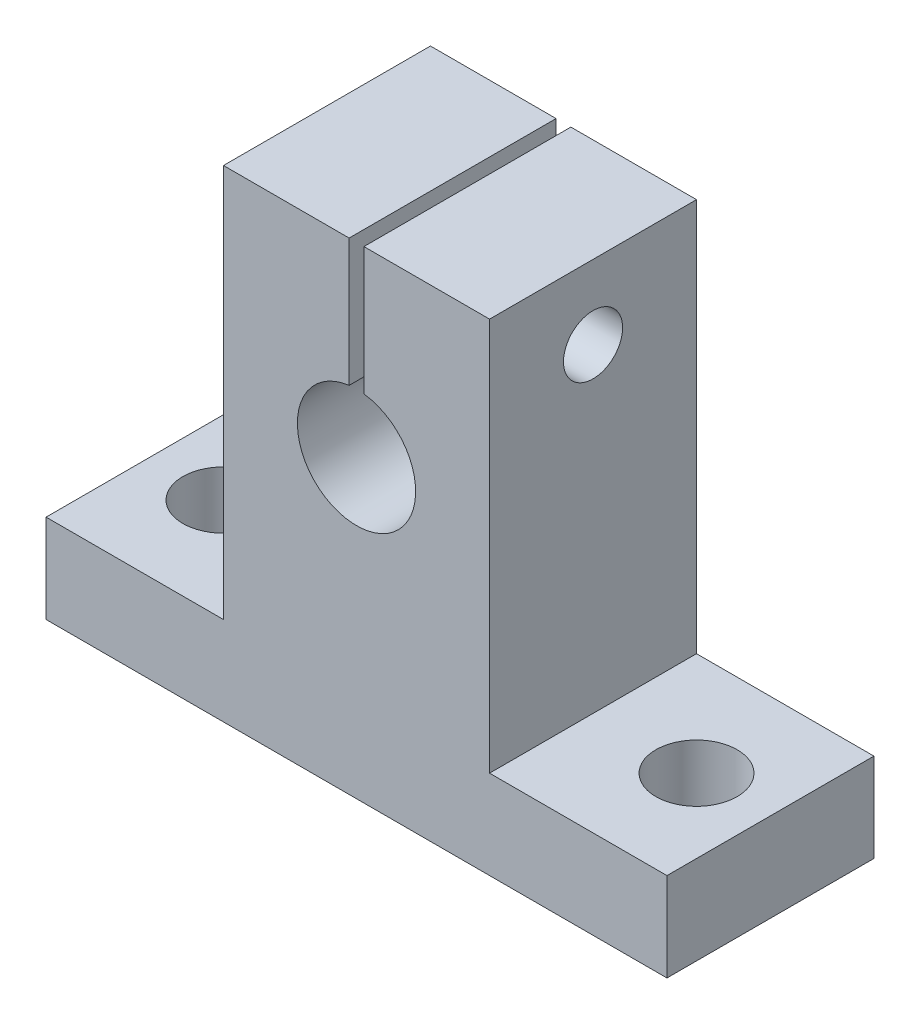
from build123d import *

# Parameters (mm, degrees)
SKETCH_1_R          = 4
EXTRUDE_1_DEPTH     = 14
SKETCH_2_R          = 2.75
CUT_EXTRUDE_1_DEPTH = 37.66824239
SKETCH_3_R          = 2
CUT_EXTRUDE_2_DEPTH = 47.462457963
CUT_EXTRUDE_3_REACH = 43.228
SKETCH_4_W          = 1
SKETCH_4_H          = 8.631373033


with BuildPart() as part:
    # 草图1 → 凸台-拉伸1 (new body)
    with BuildSketch(Plane.XY):
        Polygon((21, 0), (-21, 0), (-21, 6), (-9, 6), (-9, 32.6), (9, 32.6), (9, 6), (21, 6), align=None)
        with Locations((0, 20)):
            Circle(SKETCH_1_R, mode=Mode.SUBTRACT)
    extrude(amount=EXTRUDE_1_DEPTH)

    # 草图2 → 切除-拉伸1 (cut, through all)
    with BuildSketch(Plane(origin=(0, 6, 0), x_dir=(1, 0, 0), z_dir=(0, 1, 0))):
        with Locations(Location((16, -7, 0), (0, 0, 270))):
            Circle(SKETCH_2_R)
        with Locations(Location((-16, -7, 0), (0, 0, 90))):
            Circle(SKETCH_2_R)
    extrude(amount=-CUT_EXTRUDE_1_DEPTH, mode=Mode.SUBTRACT)

    # 草图3 → 切除-拉伸2 (cut, through all)
    with BuildSketch(Plane.ZY.offset(9)):
        with Locations((7, 27.6)):
            Circle(SKETCH_3_R)
    extrude(amount=-CUT_EXTRUDE_2_DEPTH, mode=Mode.SUBTRACT)

    # 草图4 → 切除-拉伸3 (cut, up to next)
    with BuildSketch(Plane.XY.offset(14), mode=Mode.PRIVATE) as cut_extrude_3_sk1:
        with Locations((0, 28.284313484)):
            Rectangle(SKETCH_4_W, SKETCH_4_H)
    cut_extrude_3_tool1 = extrude(cut_extrude_3_sk1.sketch, amount=-CUT_EXTRUDE_3_REACH, mode=Mode.PRIVATE) & part.part
    add(cut_extrude_3_tool1.solids().sort_by_distance((0, 28.284313, 14))[0], mode=Mode.SUBTRACT)


solid = part.part
